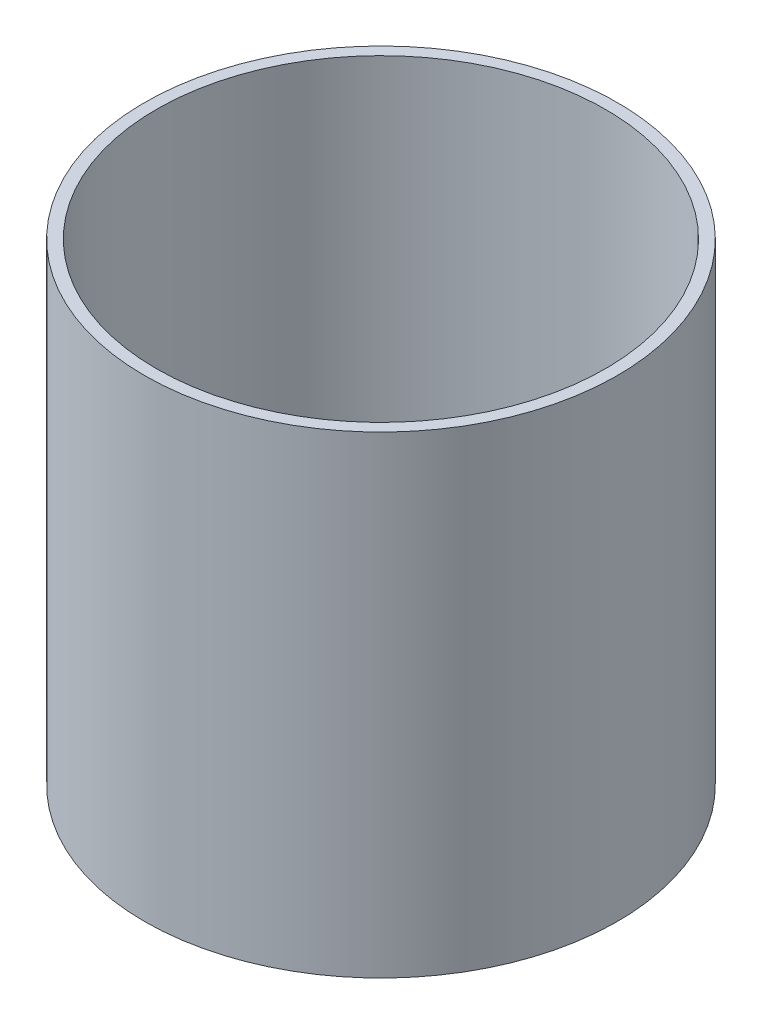
from build123d import *

# Parameters (mm, degrees)
SKETCH1_R           = 50
BOSS_EXTRUDE1_DEPTH = 100
SKETCH2_R           = 47.5
CUT_EXTRUDE1_DEPTH  = 95


with BuildPart() as part:
    # Sketch1 → Boss-Extrude1 (new body)
    with BuildSketch(Plane(origin=(0, 0, 0), x_dir=(1, 0, 0), z_dir=(0, 1, 0))):
        with Locations(Location((-36.40287639, 20.223820217, 0), (0, 0, 270))):
            Circle(SKETCH1_R)
    extrude(amount=BOSS_EXTRUDE1_DEPTH)

    # Sketch2 → Cut-Extrude1 (cut)
    with BuildSketch(Plane(origin=(0, 100, 0), x_dir=(1, 0, 0), z_dir=(0, 1, 0))):
        with Locations(Location((-36.40287639, 20.223820217, 0), (0, 0, 270))):
            Circle(SKETCH2_R)
    extrude(amount=-CUT_EXTRUDE1_DEPTH, mode=Mode.SUBTRACT)


solid = part.part
